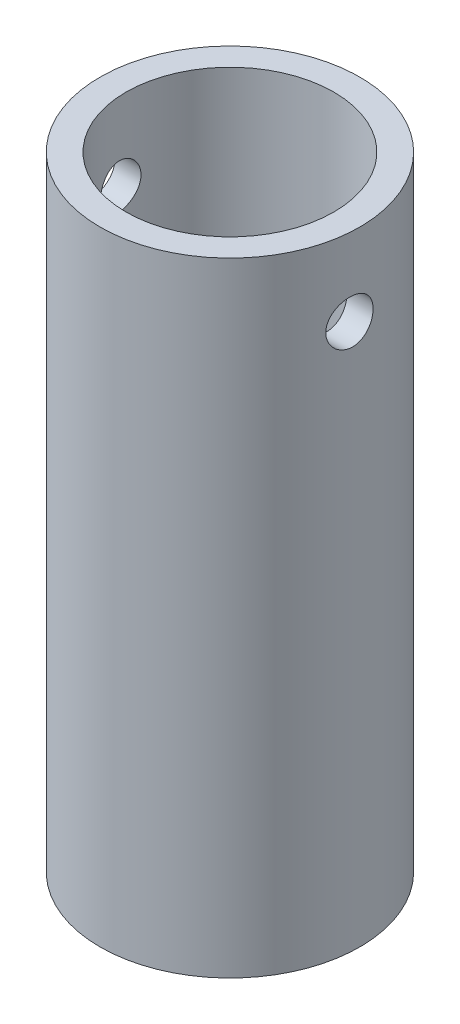
from build123d import *

# Parameters (mm, degrees)
SKETCH2_R            = 7.9375
PISTONE_BASE_DEPTH   = 38.1
SKETCH3_R            = 6.35
DRILL_HOLE_1_DEPTH   = 19.05
TOP_WHOLE_DEPTH      = 40.71923731
TOP_WHOLE_DEPTH_BACK = 40.71923731
SKETCH6_R            = 1.3589


with BuildPart() as part:
    # Sketch2 → Pistone Base (new body)
    with BuildSketch(Plane(origin=(0, 0, 0), x_dir=(1, 0, 0), z_dir=(0, 1, 0))):
        with Locations(Location((0, 0, 0), (0, 0, 90))):
            Circle(SKETCH2_R)
    extrude(amount=PISTONE_BASE_DEPTH)

    # Sketch3 → Drill Hole 1 (cut)
    with BuildSketch(Plane(origin=(0, 38.1, 0), x_dir=(1, 0, 0), z_dir=(0, 1, 0))):
        with Locations(Location((0, 0, 0), (0, 0, 270))):
            Circle(SKETCH3_R)
    extrude(amount=-DRILL_HOLE_1_DEPTH, mode=Mode.SUBTRACT)

    # Sketch6 → Top Whole (cut, two sides: drawn at the far end of the back side and taken through both)
    with BuildSketch(Plane(origin=(0, 0, 0), x_dir=(0, 0, -1), z_dir=(1, 0, 0)).offset(-TOP_WHOLE_DEPTH_BACK)):
        with Locations((-0.502050886, 33.3248)):
            Circle(SKETCH6_R)
    extrude(amount=TOP_WHOLE_DEPTH + TOP_WHOLE_DEPTH_BACK, mode=Mode.SUBTRACT)


solid = part.part
